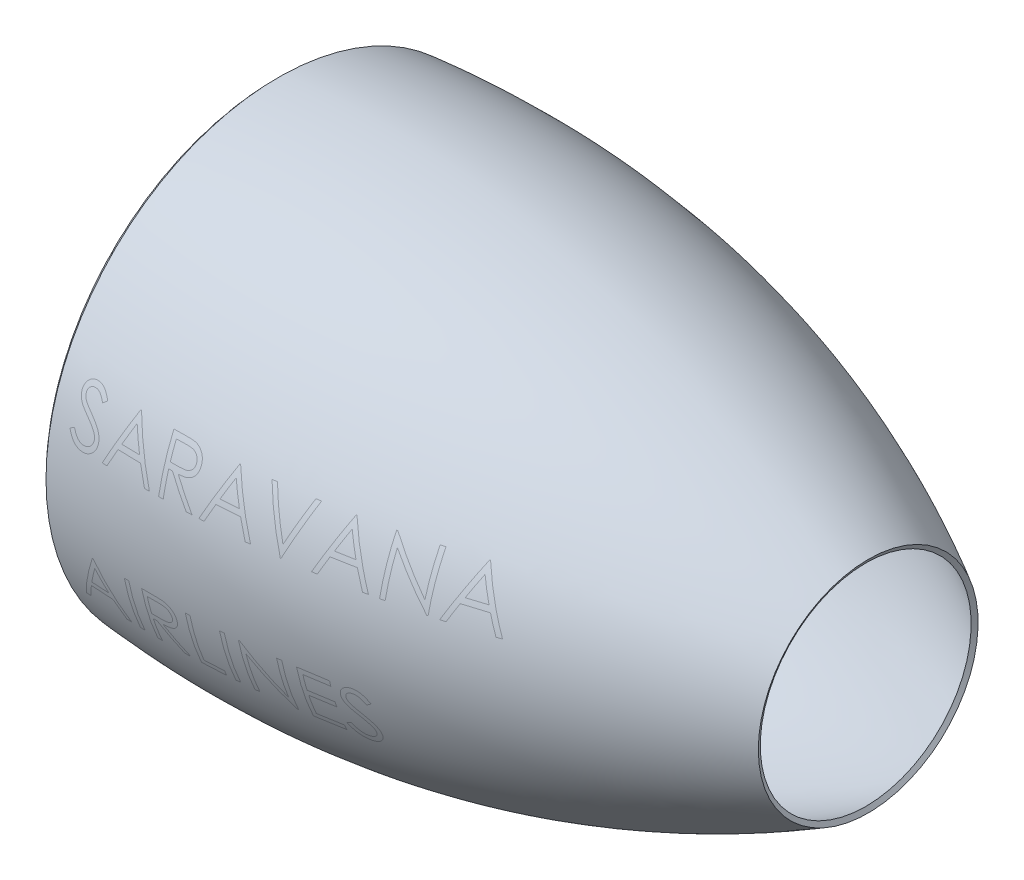
from build123d import *

# Parameters (mm, degrees)
THICKEN1_T1 = 5


with BuildPart() as body_1:
    # Surface-Revolve1: a surface, the sketch's curves turned about an axis
    with BuildLine(Plane.XY, mode=Mode.PRIVATE) as surface_revolve1_1_path:
        Line((69.847875936, 190), (44.847875936, 190))
        Line((44.847875936, 190), (25, 180))
        Line((25, 180), (0, 180))
        add(Edge.make_bspline(
            [(0, 180), (-24.468471325, 203.728033272), (0, 228.154055572)],
            knots=[0, 0, 0, 1, 1, 1], degree=2))
        add(Edge.make_bspline(
            [(0, 228.154055572), (313.095443169, 257.588468362), (580, 108)],
            knots=[0, 0, 0, 1, 1, 1], degree=2))
    surface_revolve1_1 = Shell.revolve(surface_revolve1_1_path.wire(), 360, Axis((621.678743961, 0, 0), (-1, 0, 0)))
    add(Solid.thicken(surface_revolve1_1, THICKEN1_T1))


solid = body_1.part
